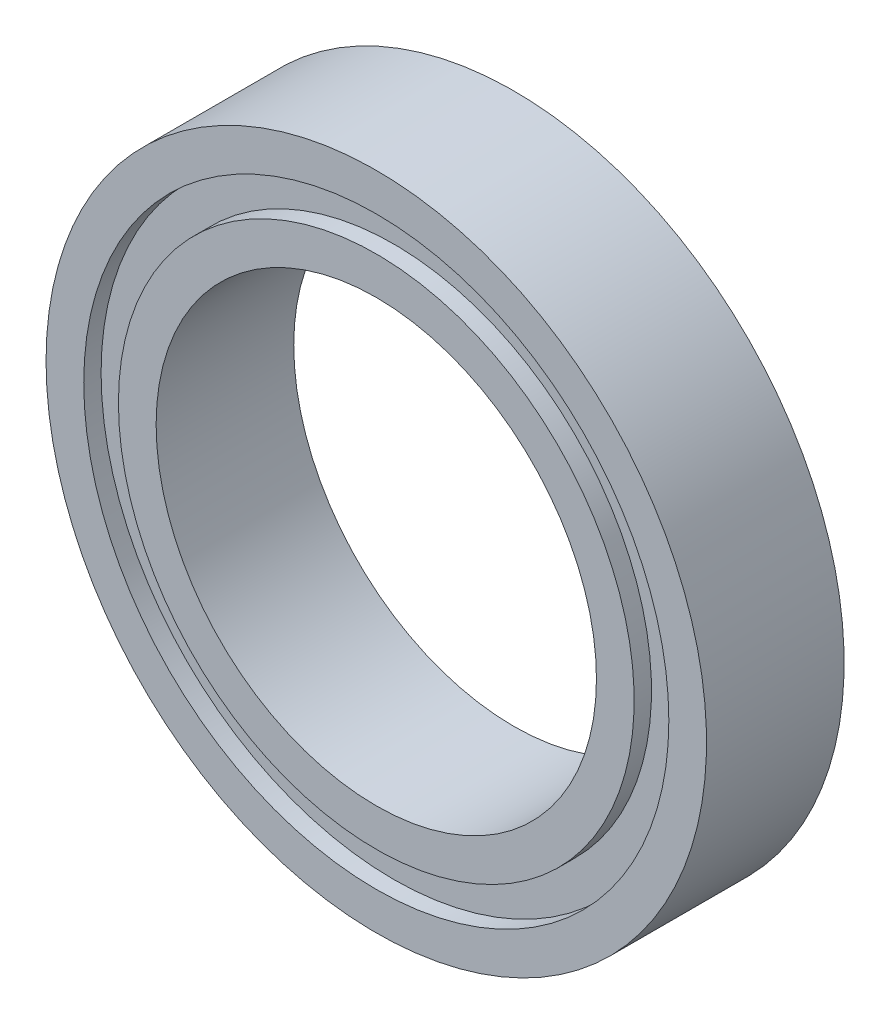
from build123d import *


with BuildPart() as part:
    # Sketch1 → Revolve1 (revolve)
    with BuildSketch(Plane(origin=(0, 0, 0), x_dir=(1, 0, 0), z_dir=(0, 1, 0))):
        Polygon((-6.35, -1.984375), (-6.35, 1.984375), (-7.4375, 1.984375), (-7.4375, 1.484375), (-8.4375, 1.484375), (-8.4375, 1.984375), (-9.525, 1.984375), (-9.525, -1.984375), (-8.4375, -1.984375), (-8.4375, -1.484375), (-7.4375, -1.484375), (-7.4375, -1.984375), align=None)
    revolve(axis=Axis((0, 0, -1.984375), (0, 0, 1)))


solid = part.part
